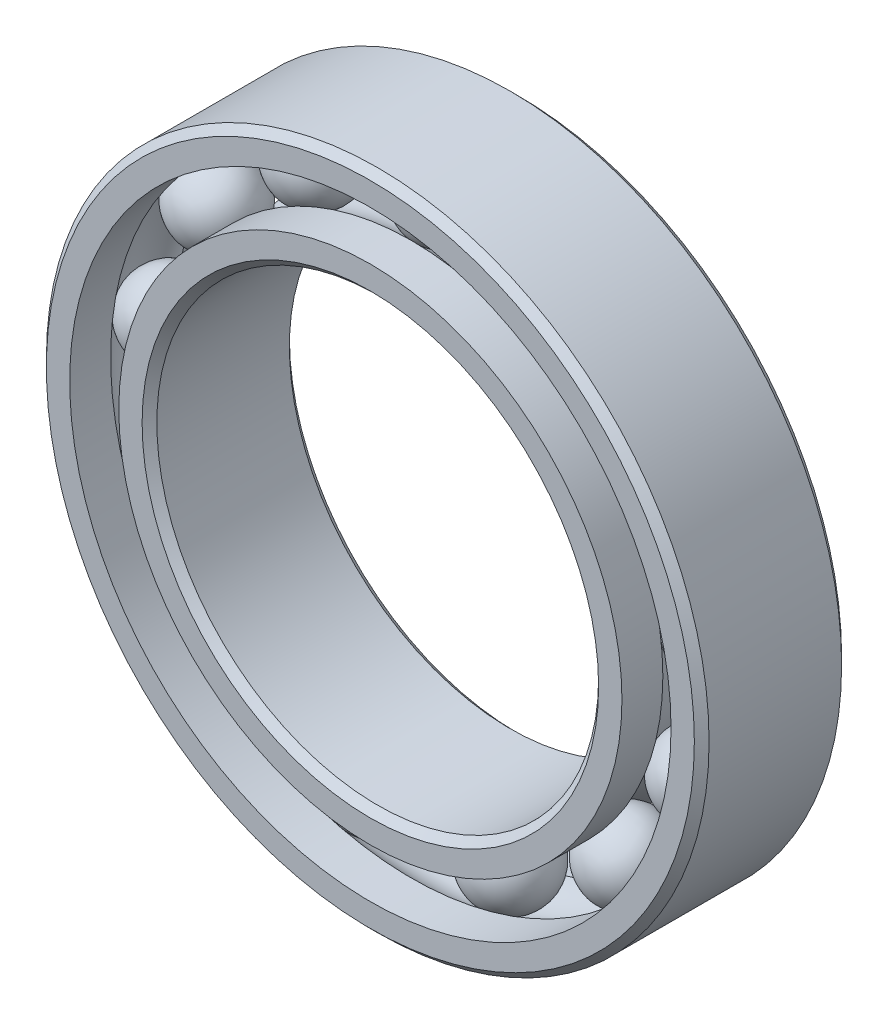
from build123d import *

# Parameters (mm, degrees)
CIRPATTERN1_COUNT = 13


with BuildPart() as part:
    # Sketch5 → Revolve1 (revolve)
    with BuildSketch(Plane(origin=(0, 0, 0), x_dir=(0, 0, -1), z_dir=(1, 0, 0))):
        with BuildLine():
            Line((1.8, 9), (-1.8, 9))
            Line((-1.8, 9), (-2, 8.8))
            Line((-2, 8.8), (-2, 8.166666667))
            Line((-2, 8.166666667), (-0.888888889, 8.166666667))
            ThreePointArc((-0.888888889, 8.166666667), (0, 8.611111111), (0.888888889, 8.166666667))
            Line((0.888888889, 8.166666667), (2, 8.166666667))
            Line((2, 8.166666667), (2, 8.8))
            Line((2, 8.8), (1.8, 9))
        make_face()
    revolve(axis=Axis((0, 0, 2), (0, 0, -1)))


with BuildPart() as body_2:
    # Sketch3 → Revolve3 (revolve)
    with BuildSketch(Plane(origin=(0, 0, 0), x_dir=(0, 0, -1), z_dir=(1, 0, 0))):
        with BuildLine():
            Line((-2, 6.833333333), (-0.888888889, 6.833333333))
            ThreePointArc((-0.888888889, 6.833333333), (0, 6.388888889), (0.888888889, 6.833333333))
            Line((0.888888889, 6.833333333), (2, 6.833333333))
            Line((2, 6.833333333), (2, 6.2))
            Line((2, 6.2), (1.8, 6))
            Line((1.8, 6), (-1.8, 6))
            Line((-1.8, 6), (-2, 6.2))
            Line((-2, 6.2), (-2, 6.833333333))
        make_face()
    revolve(axis=Axis((0, 0, 2), (0, 0, -1)))


with BuildPart() as body_3:
    # Sketch4 → Revolve4 (revolve)
    with BuildSketch(Plane(origin=(0, 0, 0), x_dir=(0, 0, -1), z_dir=(1, 0, 0))):
        with BuildLine():
            Line((-1.111111111, 7.5), (1.111111111, 7.5))
            ThreePointArc((1.111111111, 7.5), (0, 8.611111111), (-1.111111111, 7.5))
        make_face()
    revolve(axis=Axis((0, 7.5, 1.111111111), (0, 0, -1)))


with BuildPart() as cirpattern1_1:
    # CirPattern1: pattern copy
    add(body_3.part.rotate(Axis((0, 0, 0), (0, 0, 1)), 1 * 360 / CIRPATTERN1_COUNT))


with BuildPart() as cirpattern1_2:
    # CirPattern1: pattern copy
    add(body_3.part.rotate(Axis((0, 0, 0), (0, 0, 1)), 2 * 360 / CIRPATTERN1_COUNT))


with BuildPart() as cirpattern1_3:
    # CirPattern1: pattern copy
    add(body_3.part.rotate(Axis((0, 0, 0), (0, 0, 1)), 3 * 360 / CIRPATTERN1_COUNT))


with BuildPart() as cirpattern1_4:
    # CirPattern1: pattern copy
    add(body_3.part.rotate(Axis((0, 0, 0), (0, 0, 1)), 4 * 360 / CIRPATTERN1_COUNT))


with BuildPart() as cirpattern1_5:
    # CirPattern1: pattern copy
    add(body_3.part.rotate(Axis((0, 0, 0), (0, 0, 1)), 5 * 360 / CIRPATTERN1_COUNT))


with BuildPart() as cirpattern1_6:
    # CirPattern1: pattern copy
    add(body_3.part.rotate(Axis((0, 0, 0), (0, 0, 1)), 6 * 360 / CIRPATTERN1_COUNT))


with BuildPart() as cirpattern1_7:
    # CirPattern1: pattern copy
    add(body_3.part.rotate(Axis((0, 0, 0), (0, 0, 1)), 7 * 360 / CIRPATTERN1_COUNT))


with BuildPart() as cirpattern1_8:
    # CirPattern1: pattern copy
    add(body_3.part.rotate(Axis((0, 0, 0), (0, 0, 1)), 8 * 360 / CIRPATTERN1_COUNT))


with BuildPart() as cirpattern1_9:
    # CirPattern1: pattern copy
    add(body_3.part.rotate(Axis((0, 0, 0), (0, 0, 1)), 9 * 360 / CIRPATTERN1_COUNT))


with BuildPart() as cirpattern1_10:
    # CirPattern1: pattern copy
    add(body_3.part.rotate(Axis((0, 0, 0), (0, 0, 1)), 10 * 360 / CIRPATTERN1_COUNT))


with BuildPart() as cirpattern1_11:
    # CirPattern1: pattern copy
    add(body_3.part.rotate(Axis((0, 0, 0), (0, 0, 1)), 11 * 360 / CIRPATTERN1_COUNT))


with BuildPart() as cirpattern1_12:
    # CirPattern1: pattern copy
    add(body_3.part.rotate(Axis((0, 0, 0), (0, 0, 1)), 12 * 360 / CIRPATTERN1_COUNT))


solid = Compound([part.part, body_2.part, body_3.part, cirpattern1_1.part, cirpattern1_2.part, cirpattern1_3.part, cirpattern1_4.part, cirpattern1_5.part, cirpattern1_6.part, cirpattern1_7.part, cirpattern1_8.part, cirpattern1_9.part, cirpattern1_10.part, cirpattern1_11.part, cirpattern1_12.part])
